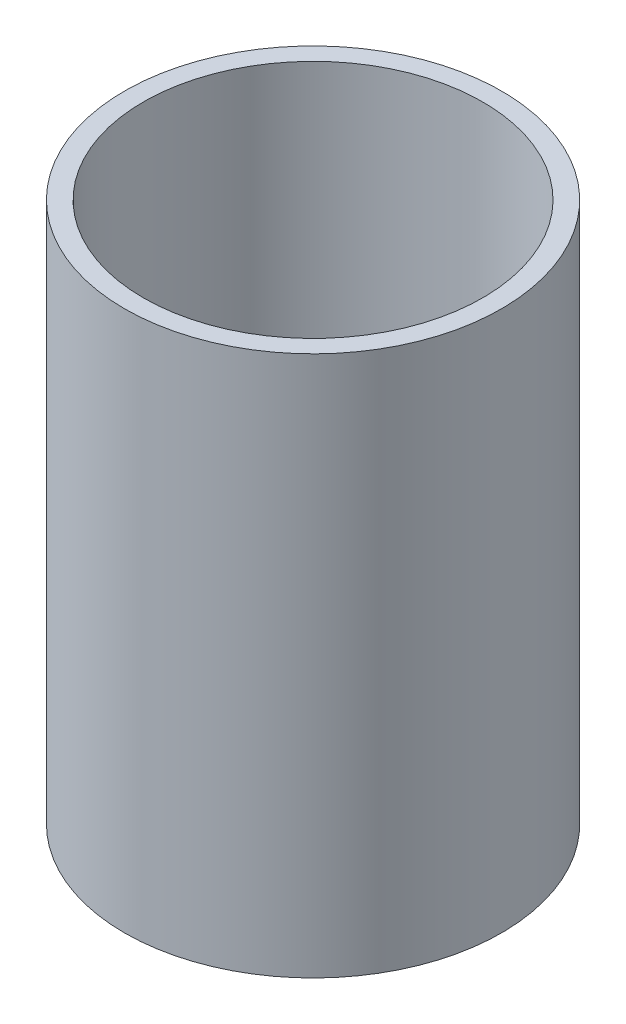
from build123d import *

# Parameters (mm, degrees)
SKETCH_1_R      = 15
SKETCH_1_R_2    = 13.5
EXTRUDE_1_DEPTH = 43


with BuildPart() as part:
    # 草图1 → 凸台-拉伸1 (new body)
    with BuildSketch(Plane(origin=(0, 0, 0), x_dir=(1, 0, 0), z_dir=(0, 1, 0))):
        with Locations(Location((0, 0, 0), (0, 0, 270))):
            Circle(SKETCH_1_R)
        with Locations(Location((0, 0, 0), (0, 0, 270))):
            Circle(SKETCH_1_R_2, mode=Mode.SUBTRACT)
    extrude(amount=EXTRUDE_1_DEPTH)


solid = part.part
